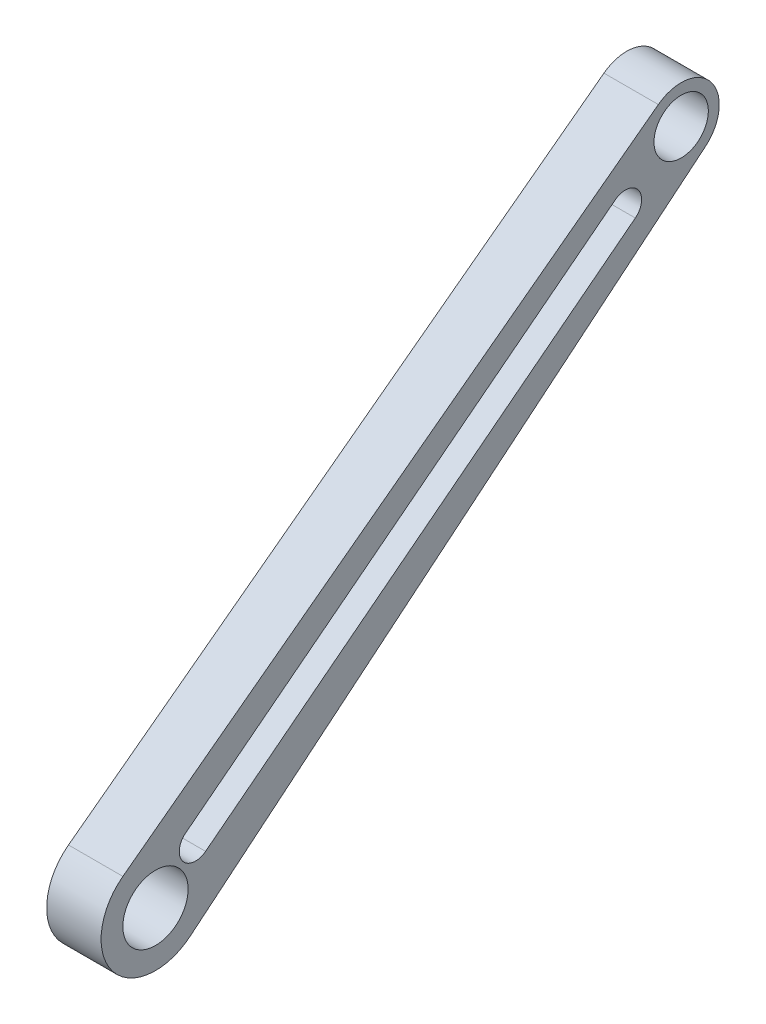
from build123d import *

# Parameters (mm, degrees)
IZIM1_R                     = 30
IZIM1_R_2                   = 25
Y_KSEKLIK_EKSTR_ZYON1_DEPTH = 50


with BuildPart() as part:
    # Çizim1 → Yükseklik-Ekstrüzyon1 (new body)
    with BuildSketch(Plane(origin=(0, 0, 0), x_dir=(0, 0, -1), z_dir=(1, 0, 0))):
        with BuildLine():
            Line((-29.957425106, 40.031895796), (462.164144906, 408.305613126))
            ThreePointArc((462.164144906, 408.305613126), (510.636731761, 401.930886023), (505.446458587, 353.317205989))
            Line((505.446458587, 353.317205989), (31.874451582, -38.522971541))
            ThreePointArc((31.874451582, -38.522971541), (-39.289127545, -30.925142793), (-29.957425106, 40.031895796))
        make_face()
        Circle(IZIM1_R, mode=Mode.SUBTRACT)
        with Locations((483.13434248, 380.283286068)):
            Circle(IZIM1_R_2, mode=Mode.SUBTRACT)
        with BuildLine():
            Line((27.64479889, 45.650239762), (422.592515956, 352.271016592))
            ThreePointArc((422.592515956, 352.271016592), (443.639570773, 349.621208385), (440.989762566, 328.574153568))
            Line((440.989762566, 328.574153568), (46.0420455, 21.953376738))
            ThreePointArc((46.0420455, 21.953376738), (24.994990683, 24.603184945), (27.64479889, 45.650239762))
        make_face(mode=Mode.SUBTRACT)
    extrude(amount=Y_KSEKLIK_EKSTR_ZYON1_DEPTH)


solid = part.part
